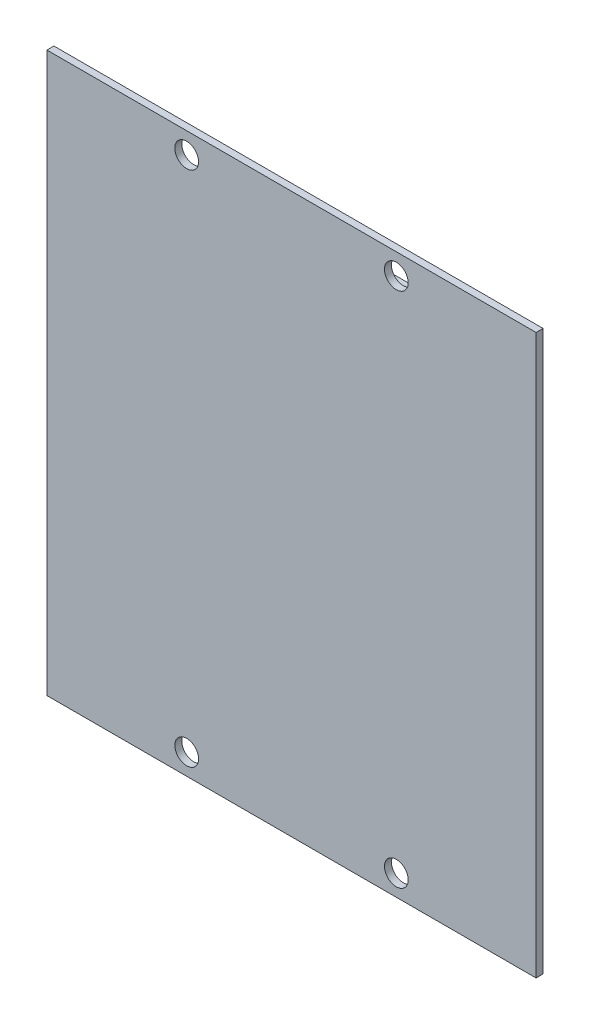
from build123d import *

# Parameters (mm, degrees)
SKETCH1_W                   = 70
SKETCH1_H                   = 80
BOSS_EXTRUDE1_DEPTH         = 1
SKETCH2_W                   = 45.5
SKETCH2_H                   = 48
BOSS_EXTRUDE2_DEPTH         = 13
LO_M3_BAT_DRIVER_DEPTH      = 55.717456081
LO_M3_BAT_DRIVER_DEPTH_BACK = 55.717456081
SKETCH3_R                   = 1.7


with BuildPart() as part:
    # Sketch1 → Boss-Extrude1 (new body)
    with BuildSketch(Plane.XY):
        Rectangle(SKETCH1_W, SKETCH1_H)
    extrude(amount=-BOSS_EXTRUDE1_DEPTH)

    # Sketch2 → Boss-Extrude2 (add)
    with BuildSketch(Plane.XY):
        Rectangle(SKETCH2_W, SKETCH2_H)
    extrude(amount=-BOSS_EXTRUDE2_DEPTH)

    # Sketch3 → Lo_M3_bat_driver (cut, two sides: drawn at the far end of the back side and taken through both)
    with BuildSketch(Plane.XY.offset(-LO_M3_BAT_DRIVER_DEPTH_BACK)):
        with Locations(Location((-15, -37, 0), (0, 0, 180))):
            Circle(SKETCH3_R)
        with Locations(Location((-15, 37, 0), (0, 0, 180))):
            Circle(SKETCH3_R)
        with Locations(Location((15, -37, 0), (0, 0, 180))):
            Circle(SKETCH3_R)
        with Locations(Location((15, 37, 0), (0, 0, 180))):
            Circle(SKETCH3_R)
    extrude(amount=LO_M3_BAT_DRIVER_DEPTH + LO_M3_BAT_DRIVER_DEPTH_BACK, mode=Mode.SUBTRACT)


solid = part.part
